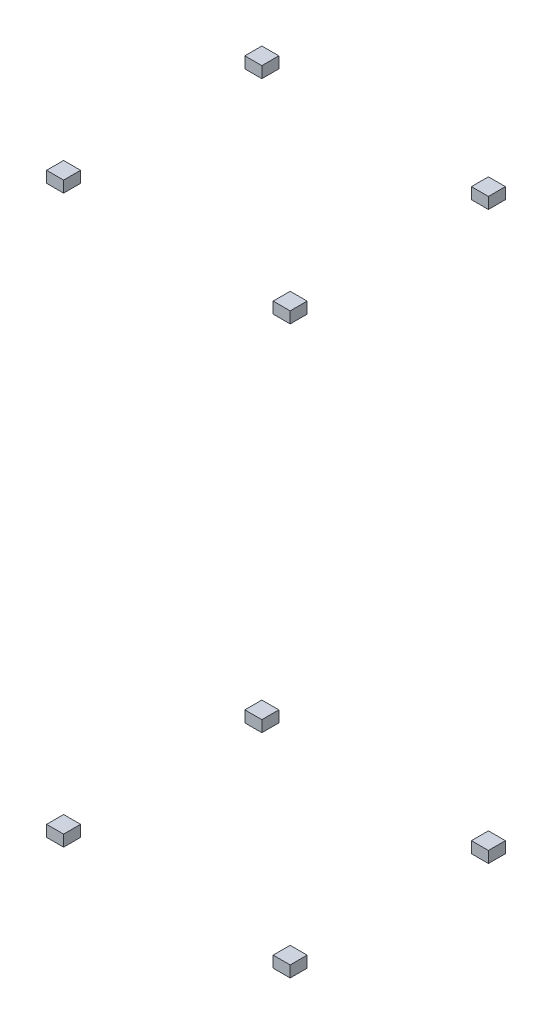
from build123d import *

# Parameters (mm, degrees)
BOSS_EXTRUDE1_START = -760
SKETCH1_W           = 120
SKETCH1_H           = 80
BOSS_EXTRUDE1_DEPTH = 120
BOSS_EXTRUDE2_START = 640
SKETCH2_W           = 120
SKETCH2_H           = 80
BOSS_EXTRUDE2_DEPTH = 120
BOSS_EXTRUDE3_START = -760
SKETCH3_W           = 120
SKETCH3_H           = 80
BOSS_EXTRUDE3_DEPTH = 120
BOSS_EXTRUDE4_START = 640
SKETCH4_W           = 120
SKETCH4_H           = 80
BOSS_EXTRUDE4_DEPTH = 120
BOSS_EXTRUDE5_START = -760
SKETCH5_W           = 120
SKETCH5_H           = 80
BOSS_EXTRUDE5_DEPTH = 120
BOSS_EXTRUDE6_START = 640
SKETCH6_W           = 120
SKETCH6_H           = 80
BOSS_EXTRUDE6_DEPTH = 120
BOSS_EXTRUDE7_START = -760
SKETCH7_W           = 120
SKETCH7_H           = 80
BOSS_EXTRUDE7_DEPTH = 120
BOSS_EXTRUDE8_START = 640
SKETCH8_W           = 120
SKETCH8_H           = 80
BOSS_EXTRUDE8_DEPTH = 120


with BuildPart() as part:
    # Sketch1 → Boss-Extrude1 (new body)
    with BuildSketch(Plane.XY.offset(BOSS_EXTRUDE1_START)):
        with Locations((-800, -2000)):
            Rectangle(SKETCH1_W, SKETCH1_H)
    extrude(amount=BOSS_EXTRUDE1_DEPTH)


with BuildPart() as body_2:
    # Sketch2 → Boss-Extrude2 (new body)
    with BuildSketch(Plane.XY.offset(BOSS_EXTRUDE2_START)):
        with Locations((-800, -2000)):
            Rectangle(SKETCH2_W, SKETCH2_H)
    extrude(amount=BOSS_EXTRUDE2_DEPTH)


with BuildPart() as body_3:
    # Sketch3 → Boss-Extrude3 (new body)
    with BuildSketch(Plane.XY.offset(BOSS_EXTRUDE3_START)):
        with Locations((-800, 2000)):
            Rectangle(SKETCH3_W, SKETCH3_H)
    extrude(amount=BOSS_EXTRUDE3_DEPTH)


with BuildPart() as body_4:
    # Sketch4 → Boss-Extrude4 (new body)
    with BuildSketch(Plane.XY.offset(BOSS_EXTRUDE4_START)):
        with Locations((-800, 2000)):
            Rectangle(SKETCH4_W, SKETCH4_H)
    extrude(amount=BOSS_EXTRUDE4_DEPTH)


with BuildPart() as body_5:
    # Sketch5 → Boss-Extrude5 (new body)
    with BuildSketch(Plane.XY.offset(BOSS_EXTRUDE5_START)):
        with Locations((800, -2000)):
            Rectangle(SKETCH5_W, SKETCH5_H)
    extrude(amount=BOSS_EXTRUDE5_DEPTH)


with BuildPart() as body_6:
    # Sketch6 → Boss-Extrude6 (new body)
    with BuildSketch(Plane.XY.offset(BOSS_EXTRUDE6_START)):
        with Locations((800, -2000)):
            Rectangle(SKETCH6_W, SKETCH6_H)
    extrude(amount=BOSS_EXTRUDE6_DEPTH)


with BuildPart() as body_7:
    # Sketch7 → Boss-Extrude7 (new body)
    with BuildSketch(Plane.XY.offset(BOSS_EXTRUDE7_START)):
        with Locations((800, 2000)):
            Rectangle(SKETCH7_W, SKETCH7_H)
    extrude(amount=BOSS_EXTRUDE7_DEPTH)


with BuildPart() as body_8:
    # Sketch8 → Boss-Extrude8 (new body)
    with BuildSketch(Plane.XY.offset(BOSS_EXTRUDE8_START)):
        with Locations((800, 2000)):
            Rectangle(SKETCH8_W, SKETCH8_H)
    extrude(amount=BOSS_EXTRUDE8_DEPTH)


solid = Compound([part.part, body_2.part, body_3.part, body_4.part, body_5.part, body_6.part, body_7.part, body_8.part])
